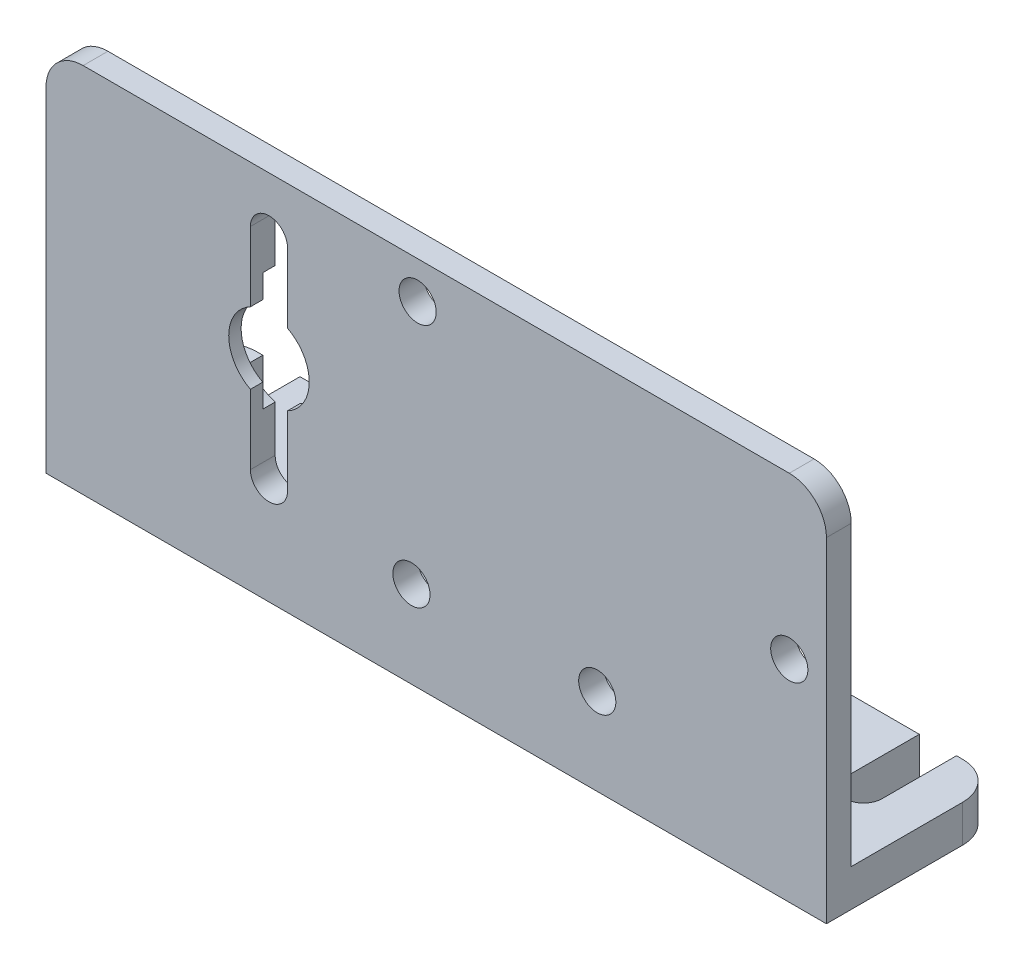
from build123d import *

# Parameters (mm, degrees)
SKETCH1_W           = 63
SKETCH1_H           = 30
BOSS_EXTRUDE1_DEPTH = 2
SKETCH2_W           = 63
SKETCH2_H           = 3
BOSS_EXTRUDE2_DEPTH = 12
CUT_EXTRUDE1_DEPTH  = 44.188540147
FILLET1_R           = 3
CUT_EXTRUDE2_DEPTH  = 38.593217473
SKETCH5_R           = 5
CUT_EXTRUDE3_DEPTH  = 1
SKETCH6_R           = 3.25
CUT_EXTRUDE4_DEPTH  = 38.232378382
SKETCH7_R           = 1.5
CUT_EXTRUDE5_DEPTH  = 38.593217473


with BuildPart() as part:
    # Sketch1 → Boss-Extrude1 (new body)
    with BuildSketch(Plane.XY):
        Rectangle(SKETCH1_W, SKETCH1_H)
    extrude(amount=BOSS_EXTRUDE1_DEPTH)

    # Sketch2 → Boss-Extrude2 (add)
    with BuildSketch(Plane.XY):
        with Locations((0, -13.5)):
            Rectangle(SKETCH2_W, SKETCH2_H)
    extrude(amount=-BOSS_EXTRUDE2_DEPTH)

    # Sketch3 → Cut-Extrude1 (cut, through all)
    with BuildSketch(Plane(origin=(0, -12, 0), x_dir=(1, 0, 0), z_dir=(0, 1, 0))):
        with BuildLine():
            Line((25, 6), (25, 18))
            ThreePointArc((25, 18), (26.5, 19.5), (28, 18))
            Line((28, 18), (28, 6))
            ThreePointArc((28, 6), (26.5, 4.5), (25, 6))
        make_face()
        with BuildLine():
            Line((-25, 6), (-25, 18))
            ThreePointArc((-25, 18), (-26.5, 19.5), (-28, 18))
            Line((-28, 18), (-28, 6))
            ThreePointArc((-28, 6), (-26.5, 4.5), (-25, 6))
        make_face()
    extrude(amount=-CUT_EXTRUDE1_DEPTH, mode=Mode.SUBTRACT)

    # Fillet1
    fillet1_edges = [part.edges().sort_by_distance(p)[0] for p in [
        (-31.5, -13.5, -12),
        (31.5, -13.5, -12),
        (-31.5, 15, 1),
        (31.5, 15, 1),
    ]]
    fillet(fillet1_edges, radius=FILLET1_R)

    # Sketch4 → Cut-Extrude2 (cut, through all)
    with BuildSketch(Plane.XY.offset(2)):
        with BuildLine():
            Line((-12, 10.5), (-12, -6.5))
            ThreePointArc((-12, -6.5), (-13.5, -8), (-15, -6.5))
            Line((-15, -6.5), (-15, 10.5))
            ThreePointArc((-15, 10.5), (-13.5, 12), (-12, 10.5))
        make_face()
    extrude(amount=-CUT_EXTRUDE2_DEPTH, mode=Mode.SUBTRACT)

    # Sketch5 → Cut-Extrude3 (cut)
    with BuildSketch(Plane.XY):
        with Locations((-13.5, 2)):
            Circle(SKETCH5_R)
    extrude(amount=CUT_EXTRUDE3_DEPTH, mode=Mode.SUBTRACT)

    # Sketch6 → Cut-Extrude4 (cut, through all)
    with BuildSketch(Plane(origin=(0, 0, 1), x_dir=(-1, 0, 0), z_dir=(0, 0, -1))):
        with Locations((13.5, 2)):
            Circle(SKETCH6_R)
    extrude(amount=-CUT_EXTRUDE4_DEPTH, mode=Mode.SUBTRACT)

    # Sketch7 → Cut-Extrude5 (cut, through all)
    with BuildSketch(Plane.XY.offset(2)):
        with Locations((28.5, 2)):
            Circle(SKETCH7_R)
        with Locations((-1.5, 12)):
            Circle(SKETCH7_R)
        with Locations((-2, -8)):
            Circle(SKETCH7_R)
        with Locations((13, -8)):
            Circle(SKETCH7_R)
    extrude(amount=-CUT_EXTRUDE5_DEPTH, mode=Mode.SUBTRACT)


solid = part.part
